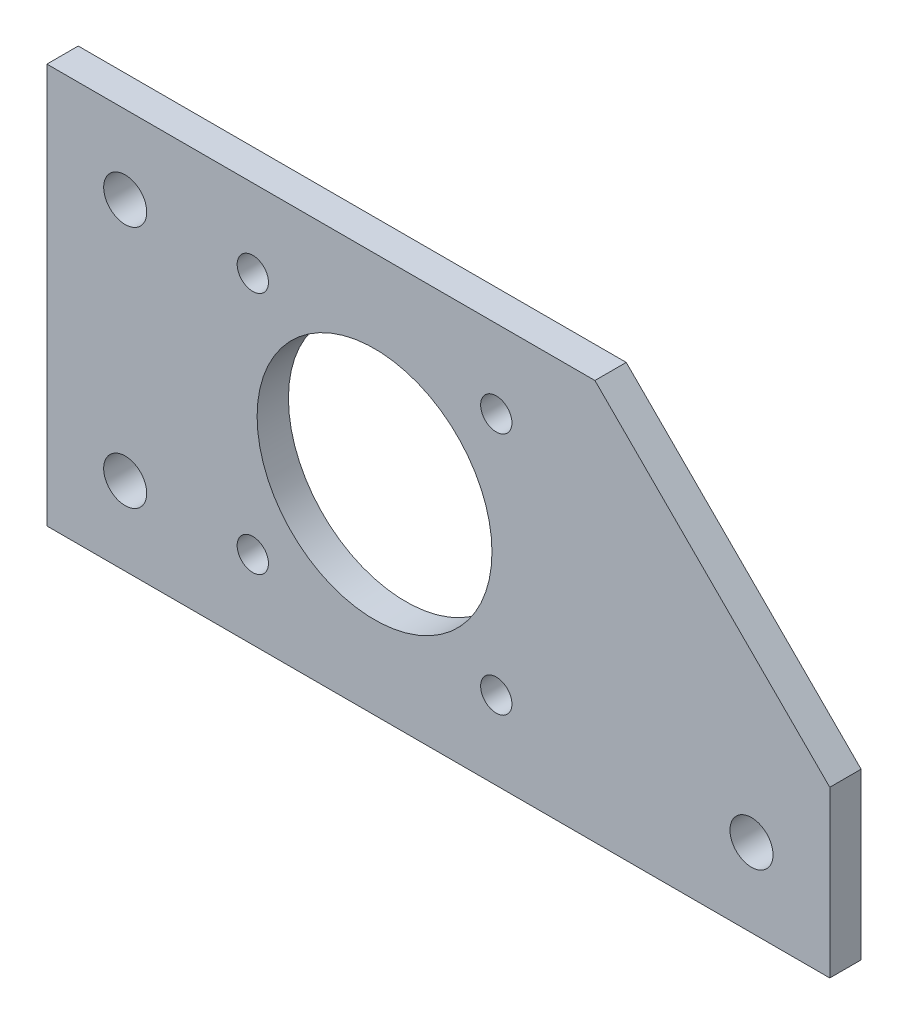
from build123d import *

# Parameters (mm, degrees)
BOSS_EXTRUDE1_DEPTH = 4
CUT_EXTRUDE1_REACH  = 42.756
SKETCH2_R           = 2
SKETCH2_R_2         = 2.75
SKETCH2_R_3         = 15
SKETCH4_W           = 4
SKETCH4_H           = 51.1
BOSS_EXTRUDE2_DEPTH = 37
CUT_EXTRUDE2_REACH  = 75.219
SKETCH5_R           = 2.75
CHAMFER2_SIZE       = 30


with BuildPart() as part:
    # Sketch1 → Boss-Extrude1 (new body)
    with BuildSketch(Plane.XY):
        Polygon((-31.5, 21.15), (-31.5, -21.15), (-31.5, -25.55), (31.5, -25.55), (31.5, -21.15), (31.5, 21.15), (31.5, 25.55), (-31.5, 25.55), align=None)
    extrude(amount=BOSS_EXTRUDE1_DEPTH)

    # Sketch2 → Cut-Extrude1 (cut, up to next)
    with BuildSketch(Plane.XY.offset(4), mode=Mode.PRIVATE) as cut_extrude1_sk1:
        with Locations((-5.2, 15.55)):
            Circle(SKETCH2_R)
    cut_extrude1_tool1 = extrude(cut_extrude1_sk1.sketch, amount=-CUT_EXTRUDE1_REACH, mode=Mode.PRIVATE) & part.part
    # Sketch2 → Cut-Extrude1 (cut, up to next)
    with BuildSketch(Plane.XY.offset(4), mode=Mode.PRIVATE) as cut_extrude1_sk2:
        with Locations((25.9, 15.55)):
            Circle(SKETCH2_R)
    cut_extrude1_tool2 = extrude(cut_extrude1_sk2.sketch, amount=-CUT_EXTRUDE1_REACH, mode=Mode.PRIVATE) & part.part
    # Sketch2 → Cut-Extrude1 (cut, up to next)
    with BuildSketch(Plane.XY.offset(4), mode=Mode.PRIVATE) as cut_extrude1_sk3:
        with Locations((25.9, -15.55)):
            Circle(SKETCH2_R)
    cut_extrude1_tool3 = extrude(cut_extrude1_sk3.sketch, amount=-CUT_EXTRUDE1_REACH, mode=Mode.PRIVATE) & part.part
    # Sketch2 → Cut-Extrude1 (cut, up to next)
    with BuildSketch(Plane.XY.offset(4), mode=Mode.PRIVATE) as cut_extrude1_sk4:
        with Locations((-5.2, -15.55)):
            Circle(SKETCH2_R)
    cut_extrude1_tool4 = extrude(cut_extrude1_sk4.sketch, amount=-CUT_EXTRUDE1_REACH, mode=Mode.PRIVATE) & part.part
    # Sketch2 → Cut-Extrude1 (cut, up to next)
    with BuildSketch(Plane.XY.offset(4), mode=Mode.PRIVATE) as cut_extrude1_sk5:
        with Locations((-21.5, 15.55)):
            Circle(SKETCH2_R_2)
    cut_extrude1_tool5 = extrude(cut_extrude1_sk5.sketch, amount=-CUT_EXTRUDE1_REACH, mode=Mode.PRIVATE) & part.part
    # Sketch2 → Cut-Extrude1 (cut, up to next)
    with BuildSketch(Plane.XY.offset(4), mode=Mode.PRIVATE) as cut_extrude1_sk6:
        with Locations((-21.5, -15.55)):
            Circle(SKETCH2_R_2)
    cut_extrude1_tool6 = extrude(cut_extrude1_sk6.sketch, amount=-CUT_EXTRUDE1_REACH, mode=Mode.PRIVATE) & part.part
    # Sketch2 → Cut-Extrude1 (cut, up to next)
    with BuildSketch(Plane.XY.offset(4), mode=Mode.PRIVATE) as cut_extrude1_sk7:
        with Locations((10.35, 0)):
            Circle(SKETCH2_R_3)
    cut_extrude1_tool7 = extrude(cut_extrude1_sk7.sketch, amount=-CUT_EXTRUDE1_REACH, mode=Mode.PRIVATE) & part.part
    add(cut_extrude1_tool1.solids().sort_by_distance((-5.2, 15.55, 4))[0], mode=Mode.SUBTRACT)
    add(cut_extrude1_tool2.solids().sort_by_distance((25.9, 15.55, 4))[0], mode=Mode.SUBTRACT)
    add(cut_extrude1_tool3.solids().sort_by_distance((25.9, -15.55, 4))[0], mode=Mode.SUBTRACT)
    add(cut_extrude1_tool4.solids().sort_by_distance((-5.2, -15.55, 4))[0], mode=Mode.SUBTRACT)
    add(cut_extrude1_tool5.solids().sort_by_distance((-21.5, 15.55, 4))[0], mode=Mode.SUBTRACT)
    add(cut_extrude1_tool6.solids().sort_by_distance((-21.5, -15.55, 4))[0], mode=Mode.SUBTRACT)
    add(cut_extrude1_tool7.solids().sort_by_distance((10.35, 0, 4))[0], mode=Mode.SUBTRACT)

    # Sketch4 → Boss-Extrude2 (add)
    with BuildSketch(Plane(origin=(31.5, 0, 0), x_dir=(0, 0, -1), z_dir=(1, 0, 0))):
        with Locations((-2, 0)):
            Rectangle(SKETCH4_W, SKETCH4_H)
    extrude(amount=BOSS_EXTRUDE2_DEPTH)

    # Sketch5 → Cut-Extrude2 (cut, up to next)
    with BuildSketch(Plane.XY.offset(4), mode=Mode.PRIVATE) as cut_extrude2_sk1:
        with Locations((58.5, -15.55)):
            Circle(SKETCH5_R)
    cut_extrude2_tool1 = extrude(cut_extrude2_sk1.sketch, amount=-CUT_EXTRUDE2_REACH, mode=Mode.PRIVATE) & part.part
    add(cut_extrude2_tool1.solids().sort_by_distance((58.5, -15.55, 4))[0], mode=Mode.SUBTRACT)

    # Chamfer2
    chamfer2_edges = [part.edges().sort_by_distance(p)[0] for p in [
        (68.5, 25.55, 2),
    ]]
    chamfer(chamfer2_edges, length=CHAMFER2_SIZE)


solid = part.part
